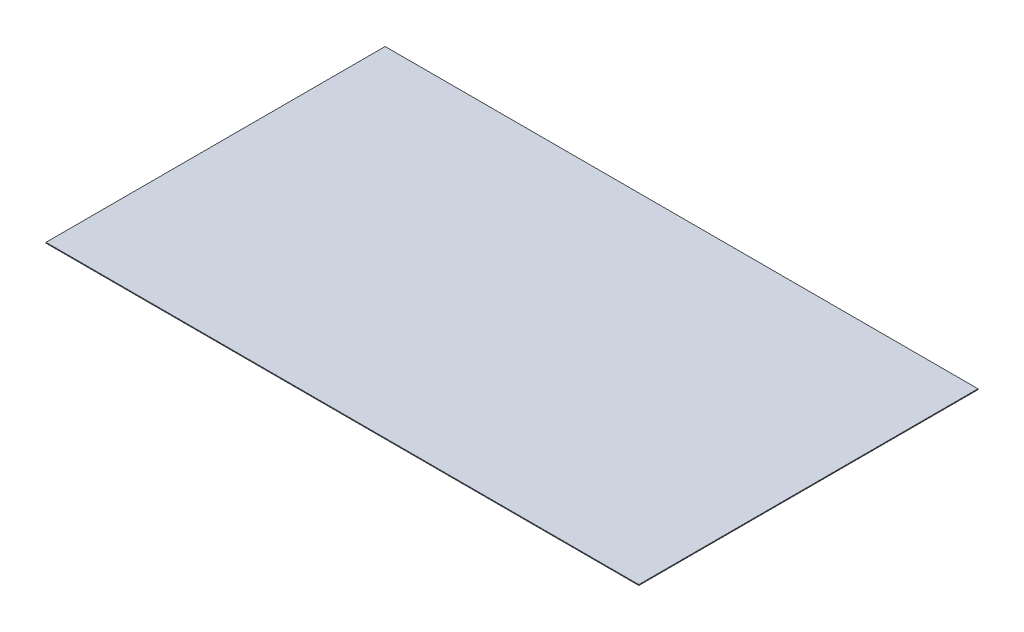
from build123d import *

# Parameters (mm, degrees)
SKETCH1_W           = 3698.796433144
SKETCH1_H           = 2115.954700668
BOSS_EXTRUDE1_DEPTH = 5


with BuildPart() as part:
    # Sketch1 → Boss-Extrude1 (new body)
    with BuildSketch(Plane(origin=(0, 0, 0), x_dir=(1, 0, 0), z_dir=(0, 1, 0))):
        Rectangle(SKETCH1_W, SKETCH1_H)
    extrude(amount=BOSS_EXTRUDE1_DEPTH)


solid = part.part
